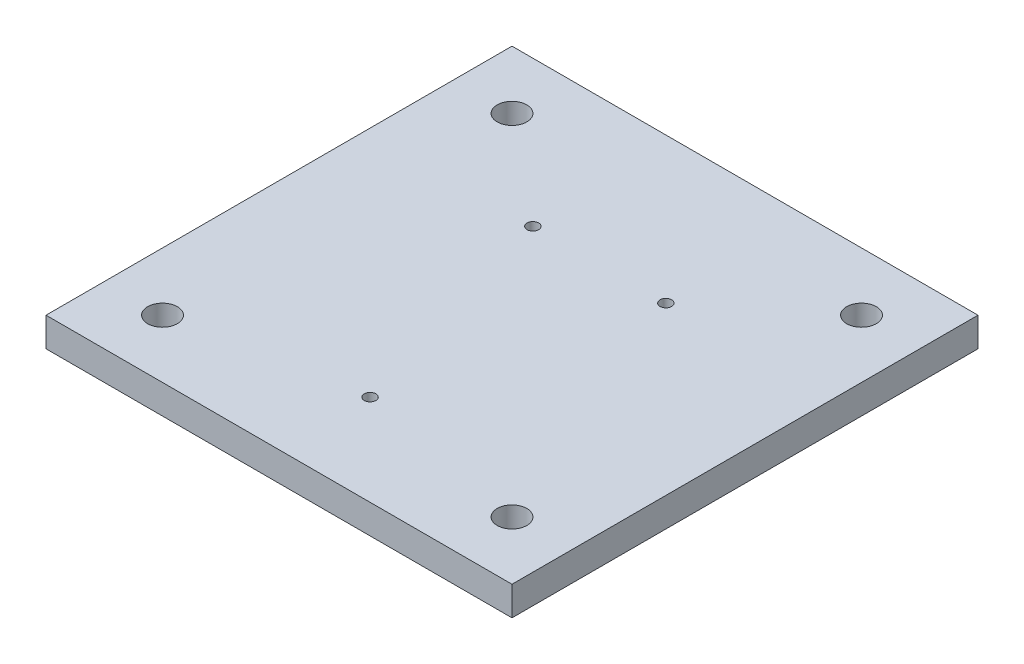
from build123d import *

# Parameters (mm, degrees)
SKETCH1_W           = 101.6
SKETCH1_H           = 101.6
SKETCH1_R           = 1.27
SKETCH1_R_2         = 3.228072168
BOSS_EXTRUDE1_DEPTH = 6.35


with BuildPart() as part:
    # Sketch1 → Boss-Extrude1 (new body)
    with BuildSketch(Plane(origin=(0, 0, 0), x_dir=(1, 0, 0), z_dir=(0, 1, 0))):
        Rectangle(SKETCH1_W, SKETCH1_H)
        with Locations(Location((-14.5, 19.05, 0), (0, 0, 270))):
            Circle(SKETCH1_R, mode=Mode.SUBTRACT)
        with Locations(Location((14.5, 19.05, 0), (0, 0, 270))):
            Circle(SKETCH1_R, mode=Mode.SUBTRACT)
        with Locations(Location((0, -30.95, 0), (0, 0, 270))):
            Circle(SKETCH1_R, mode=Mode.SUBTRACT)
        with Locations(Location((-38.1, 38.1, 0), (0, 0, 270))):
            Circle(SKETCH1_R_2, mode=Mode.SUBTRACT)
        with Locations(Location((38.1, 38.1, 0), (0, 0, 270))):
            Circle(SKETCH1_R_2, mode=Mode.SUBTRACT)
        with Locations(Location((38.1, -38.1, 0), (0, 0, 270))):
            Circle(SKETCH1_R_2, mode=Mode.SUBTRACT)
        with Locations(Location((-38.1, -38.1, 0), (0, 0, 270))):
            Circle(SKETCH1_R_2, mode=Mode.SUBTRACT)
    extrude(amount=BOSS_EXTRUDE1_DEPTH)


solid = part.part
